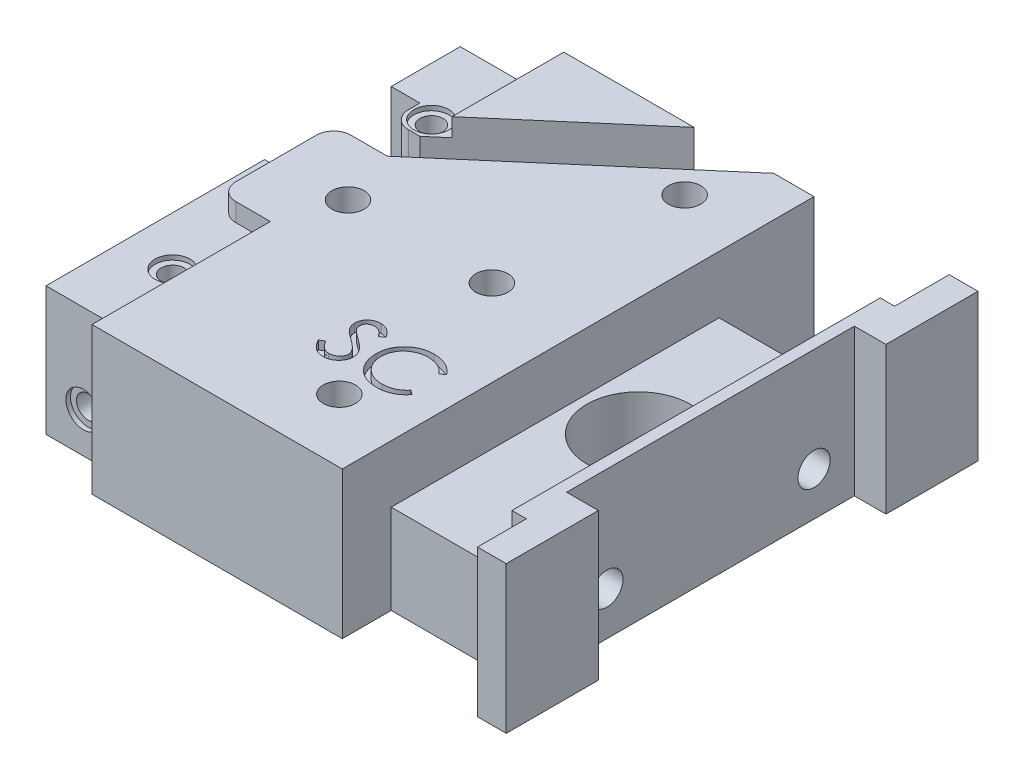
from build123d import *

# Parameters (mm, degrees)
BOSS_EXTRU_3_DEPTH       = 41
ESQUISSE8_W              = 50
ESQUISSE8_H              = 25.55
ENL_V_MAT_EXTRU_1_DEPTH  = 5.5
ESQUISSE9_R              = 9
ENL_V_MAT_EXTRU_2_DEPTH  = 96.644145142
ESQUISSE10_W             = 21
ESQUISSE10_H             = 9.5
ENL_V_MAT_EXTRU_3_DEPTH  = 96.644145142
CHANFREIN1_SIZE          = 7
ENL_V_MAT_EXTRU_6_DEPTH  = 3.175
ESQUISSE33_W             = 22
ESQUISSE33_H             = 22.375
ENL_V_MAT_EXTRU_20_DEPTH = 10
ESQUISSE34_W             = 5
ESQUISSE34_H             = 5
BOSS_EXTRU_4_DEPTH       = 22.375
ESQUISSE16_R             = 2
ENL_V_MAT_EXTRU_7_DEPTH  = 10
ESQUISSE17_R             = 3.05
ENL_V_MAT_EXTRU_8_DEPTH  = 0.8
ESQUISSE18_R             = 2.8
ENL_V_MAT_EXTRU_9_DEPTH  = 12
ESQUISSE26_W             = 13
ESQUISSE26_H             = 22.375
ENL_V_MAT_EXTRU_13_DEPTH = 5
ESQUISSE27_R             = 2
ENL_V_MAT_EXTRU_14_DEPTH = 10
ESQUISSE28_R             = 3.05
ENL_V_MAT_EXTRU_15_DEPTH = 0.8
ESQUISSE29_R             = 2.8
ENL_V_MAT_EXTRU_16_DEPTH = 10
ESQUISSE31_R             = 2.8
ENL_V_MAT_EXTRU_18_DEPTH = 10
ESQUISSE32_R             = 2.8
ENL_V_MAT_EXTRU_19_DEPTH = 10
CONG_1_R                 = 3
ENL_V_MAT_EXTRU_21_DEPTH = 16
BOSS_EXTRU_5_DEPTH       = 3.175
ESQUISSE37_W             = 2.5
ESQUISSE37_H             = 9.5
ENL_V_MAT_EXTRU_22_DEPTH = 98.769128563
ENL_V_MAT_EXTRU_23_DEPTH = 98.769128563
CHANFREIN5_SIZE          = 2
ENL_V_MAT_EXTRU_24_DEPTH = 1.5
ENL_V_MAT_EXTRU_27_REACH = 97.644
ESQUISSE42_W             = 21
ESQUISSE42_H             = 8.5
ENL_V_MAT_EXTRU_28_REACH = 99.769
ESQUISSE43_W             = 2.5
ESQUISSE43_H             = 8.5
CONG_2_R                 = 3


with BuildPart() as part:
    # Esquisse7 → Boss.-Extru.3 (new, symmetric)
    with BuildSketch(Plane.XY):
        Polygon((0, 0), (85, 0), (85, 25.55), (77.5, 25.55), (77.5, 15.55), (56.5, 15.55), (56.5, 25.55), (0, 25.55), align=None)
    extrude(amount=BOSS_EXTRU_3_DEPTH, both=True)

    # Esquisse8 → Enlèv. mat.-Extru.1 (cut)
    with BuildSketch(Plane(origin=(85, 0, 0), x_dir=(0, 0, -1), z_dir=(1, 0, 0))):
        with Locations((0, 12.775)):
            Rectangle(ESQUISSE8_W, ESQUISSE8_H)
    extrude(amount=-ENL_V_MAT_EXTRU_1_DEPTH, mode=Mode.SUBTRACT)

    # Esquisse9 → Enlèv. mat.-Extru.2 (cut, through all)
    with BuildSketch(Plane(origin=(0, 15.55, 0), x_dir=(1, 0, 0), z_dir=(0, 1, 0))):
        with Locations(Location((67, 0, 0), (0, 0, 270))):
            Circle(ESQUISSE9_R)
    extrude(amount=-ENL_V_MAT_EXTRU_2_DEPTH, mode=Mode.SUBTRACT)

    # Esquisse10 → Enlèv. mat.-Extru.3 (cut, through all)
    with BuildSketch(Plane(origin=(0, 15.55, 0), x_dir=(1, 0, 0), z_dir=(0, 1, 0))):
        with Locations((67, 36.25)):
            Rectangle(ESQUISSE10_W, ESQUISSE10_H)
    extrude(amount=-ENL_V_MAT_EXTRU_3_DEPTH, mode=Mode.SUBTRACT)

    # Chanfrein1
    chanfrein1_edges = [part.edges().sort_by_distance(p)[0] for p in [
        (67, 15.55, -31.5),
    ]]
    chamfer(chanfrein1_edges, length=CHANFREIN1_SIZE)

    # Esquisse14 → Enlèv. mat.-Extru.6 (cut)
    with BuildSketch(Plane(origin=(0, 25.55, 0), x_dir=(1, 0, 0), z_dir=(0, 1, 0))):
        Polygon((0, 41), (13, 41), (13, 10), (4, 10), (4, 0), (0, 0), (0, 10), align=None)
    enl_v_mat_extru_6 = extrude(amount=-ENL_V_MAT_EXTRU_6_DEPTH, mode=Mode.SUBTRACT)

    # Esquisse33 → Enlèv. mat.-Extru.20 (cut)
    with BuildSketch(Plane.ZY):
        with Locations((-13, 11.1875)):
            Rectangle(ESQUISSE33_W, ESQUISSE33_H)
    extrude(amount=-ENL_V_MAT_EXTRU_20_DEPTH, mode=Mode.SUBTRACT)

    # Symétrie1: Enlèv. mat.-Extru.6 across plane
    add(enl_v_mat_extru_6.mirror(Plane.XY), mode=Mode.SUBTRACT)

    # Esquisse34 → Boss.-Extru.4 (add)
    with BuildSketch(Plane(origin=(0, 22.375, 0), x_dir=(1, 0, 0), z_dir=(0, 1, 0))):
        with Locations((7.5, 21.5)):
            Rectangle(ESQUISSE34_W, ESQUISSE34_H)
    extrude(amount=-BOSS_EXTRU_4_DEPTH)

    # Esquisse16 → Enlèv. mat.-Extru.7 (cut)
    with BuildSketch(Plane(origin=(0, 22.375, 0), x_dir=(1, 0, 0), z_dir=(0, 1, 0))):
        with Locations(Location((8.5, 22.5, 0), (0, 0, 270))):
            Circle(ESQUISSE16_R)
    enl_v_mat_extru_7 = extrude(amount=-ENL_V_MAT_EXTRU_7_DEPTH, mode=Mode.SUBTRACT)

    # Esquisse17 → Enlèv. mat.-Extru.8 (cut)
    with BuildSketch(Plane(origin=(0, 22.375, 0), x_dir=(1, 0, 0), z_dir=(0, 1, 0))):
        with Locations(Location((8.5, 22.5, 0), (0, 0, 270))):
            Circle(ESQUISSE17_R)
    enl_v_mat_extru_8 = extrude(amount=-ENL_V_MAT_EXTRU_8_DEPTH, mode=Mode.SUBTRACT)

    # Symétrie2: Enlèv. mat.-Extru.7, Enlèv. mat.-Extru.8 across plane
    add(enl_v_mat_extru_7.mirror(Plane.XY), mode=Mode.SUBTRACT)
    add(enl_v_mat_extru_8.mirror(Plane.XY), mode=Mode.SUBTRACT)

    # Esquisse18 → Enlèv. mat.-Extru.9 (cut)
    with BuildSketch(Plane(origin=(79.5, 0, 0), x_dir=(0, 0, -1), z_dir=(1, 0, 0))):
        with Locations((18, 7.55)):
            Circle(ESQUISSE18_R)
    enl_v_mat_extru_9 = extrude(amount=-ENL_V_MAT_EXTRU_9_DEPTH, mode=Mode.SUBTRACT)

    # Symétrie3: Enlèv. mat.-Extru.9 across plane
    add(enl_v_mat_extru_9.mirror(Plane.XY), mode=Mode.SUBTRACT)

    # Esquisse26 → Enlèv. mat.-Extru.13 (cut)
    with BuildSketch(Plane(origin=(0, 0, -41), x_dir=(-1, 0, 0), z_dir=(0, 0, -1))):
        with Locations((-6.5, 11.1875)):
            Rectangle(ESQUISSE26_W, ESQUISSE26_H)
    enl_v_mat_extru_13 = extrude(amount=-ENL_V_MAT_EXTRU_13_DEPTH, mode=Mode.SUBTRACT)

    # Esquisse27 → Enlèv. mat.-Extru.14 (cut)
    with BuildSketch(Plane(origin=(0, 0, -36), x_dir=(-1, 0, 0), z_dir=(0, 0, -1))):
        with Locations((-6.5, 7)):
            Circle(ESQUISSE27_R)
    enl_v_mat_extru_14 = extrude(amount=-ENL_V_MAT_EXTRU_14_DEPTH, mode=Mode.SUBTRACT)

    # Esquisse28 → Enlèv. mat.-Extru.15 (cut)
    with BuildSketch(Plane(origin=(0, 0, -36), x_dir=(-1, 0, 0), z_dir=(0, 0, -1))):
        with Locations((-6.5, 7)):
            Circle(ESQUISSE28_R)
    enl_v_mat_extru_15 = extrude(amount=-ENL_V_MAT_EXTRU_15_DEPTH, mode=Mode.SUBTRACT)

    # Symétrie4: Enlèv. mat.-Extru.13, Enlèv. mat.-Extru.14, Enlèv. mat.-Extru.15 across plane
    add(enl_v_mat_extru_13.mirror(Plane.XY), mode=Mode.SUBTRACT)
    add(enl_v_mat_extru_14.mirror(Plane.XY), mode=Mode.SUBTRACT)
    add(enl_v_mat_extru_15.mirror(Plane.XY), mode=Mode.SUBTRACT)

    # Esquisse29 → Enlèv. mat.-Extru.16 (cut)
    with BuildSketch(Plane(origin=(0, 25.55, 0), x_dir=(1, 0, 0), z_dir=(0, 1, 0))):
        with Locations(Location((41.5, 0, 0), (0, 0, 270))):
            Circle(ESQUISSE29_R)
        with Locations(Location((16.5, 0, 0), (0, 0, 270))):
            Circle(ESQUISSE29_R)
    extrude(amount=-ENL_V_MAT_EXTRU_16_DEPTH, mode=Mode.SUBTRACT)

    # Esquisse31 → Enlèv. mat.-Extru.18 (cut)
    with BuildSketch(Plane(origin=(0, 25.55, 0), x_dir=(1, 0, 0), z_dir=(0, 1, 0))):
        with Locations(Location((45, -30, 0), (0, 0, 270))):
            Circle(ESQUISSE31_R)
        with Locations(Location((45, 30, 0), (0, 0, 270))):
            Circle(ESQUISSE31_R)
    extrude(amount=-ENL_V_MAT_EXTRU_18_DEPTH, mode=Mode.SUBTRACT)

    # Esquisse32 → Enlèv. mat.-Extru.19 (cut)
    with BuildSketch(Plane.XZ):
        with Locations(Location((11, 15, 0), (0, 0, 270))):
            Circle(ESQUISSE32_R)
        with Locations(Location((43, -15, 0), (0, 0, 270))):
            Circle(ESQUISSE32_R)
    extrude(amount=-ENL_V_MAT_EXTRU_19_DEPTH, mode=Mode.SUBTRACT)

    # Congé1
    cong_1_edges = [part.edges().sort_by_distance(p)[0] for p in [
        (5, 11.1875, -19),
    ]]
    fillet(cong_1_edges, radius=CONG_1_R)

    # Esquisse35 → Enlèv. mat.-Extru.21 (cut)
    with BuildSketch(Plane(origin=(0, 25.55, 0), x_dir=(1, 0, 0), z_dir=(0, 1, 0))):
        Polygon((4, 2), (49.484592656, 41), (35.657975345, 41), (10, 19), (4, 10), align=None)
    extrude(amount=-ENL_V_MAT_EXTRU_21_DEPTH, mode=Mode.SUBTRACT)

    # Esquisse36 → Boss.-Extru.5 (add)
    with BuildSketch(Plane(origin=(0, 25.55, 0), x_dir=(1, 0, 0), z_dir=(0, 1, 0))):
        Polygon((4, 1.982787623), (4, 10), (13.330172853, 10), align=None)
    extrude(amount=-BOSS_EXTRU_5_DEPTH)

    # Esquisse37 → Enlèv. mat.-Extru.22 (cut, through all)
    with BuildSketch(Plane(origin=(0, 25.55, 0), x_dir=(1, 0, 0), z_dir=(0, 1, 0))):
        with Locations((78.75, 36.25)):
            Rectangle(ESQUISSE37_W, ESQUISSE37_H)
    extrude(amount=-ENL_V_MAT_EXTRU_22_DEPTH, mode=Mode.SUBTRACT)

    # Esquisse38 → Enlèv. mat.-Extru.23 (cut, through all)
    with BuildSketch(Plane(origin=(0, 25.55, 0), x_dir=(1, 0, 0), z_dir=(0, 1, 0))):
        Polygon((49.484592656, 41), (41.087437089, 33.8), (27.260819777, 33.8), (35.657975345, 41), align=None)
    extrude(amount=-ENL_V_MAT_EXTRU_23_DEPTH, mode=Mode.SUBTRACT)

    # Chanfrein5
    chanfrein5_edges = [part.edges().sort_by_distance(p)[0] for p in [
        (34.174128433, 9.55, -33.8),
    ]]
    chamfer(chanfrein5_edges, length=CHANFREIN5_SIZE)

    # Esquisse39 → Enlèv. mat.-Extru.24 (cut)
    with BuildSketch(Plane(origin=(0, 25.55, 0), x_dir=(1, 0, 0), z_dir=(0, 1, 0))):
        with BuildLine():
            Line((34.994230769, -23.662545072), (35.799429087, -23.179807692))
            add(Edge.make_bspline(
                [(35.799429087, -23.179807692), (35.874318004, -23.305168626), (36.017802279, -23.545355336), (36.25715562, -23.869907575), (36.505167329, -24.145757444), (36.763674015, -24.371300212), (37.031097774, -24.548870396), (37.309184377, -24.67460647), (37.596996705, -24.753027089), (37.792868319, -24.762552324), (37.890655048, -24.767307692)],
                knots=[0, 0, 0, 0, 1.272034388, 2.437168799, 3.508375237, 4.49857839, 5.41946034, 6.295179144, 7.148887113, 8, 8, 8, 8], degree=3))
            add(Edge.make_bspline(
                [(37.890655048, -24.767307692), (37.974167147, -24.764981762), (38.139730079, -24.7603706), (38.383467326, -24.71606356), (38.620182088, -24.647994838), (38.844995595, -24.550510731), (39.054805803, -24.432568138), (39.238792596, -24.290111755), (39.397849518, -24.130619152), (39.527958608, -23.952684928), (39.627780704, -23.761321831), (39.704503405, -23.564900135), (39.747080355, -23.360334245), (39.753494091, -23.222601486), (39.756730769, -23.153094952)],
                knots=[0, 0, 0, 0, 1.095163259, 2.171163733, 3.241058638, 4.321873601, 5.38011039, 6.391990106, 7.366004449, 8.327778327, 9.272591725, 10.192022065, 11.087607919, 12, 12, 12, 12], degree=3))
            add(Edge.make_bspline(
                [(39.756730769, -23.153094952), (39.752718538, -23.073790211), (39.744562258, -22.912575261), (39.675624444, -22.674723348), (39.567177566, -22.439339997), (39.467130657, -22.293740124), (39.415189303, -22.218149038)],
                knots=[0, 0, 0, 0, 0.938893495, 1.908633276, 2.914225137, 4, 4, 4, 4], degree=3))
            add(Edge.make_bspline(
                [(39.415189303, -22.218149038), (39.372542846, -22.16359304), (39.283011943, -22.049059545), (39.129094713, -21.878575012), (38.948484073, -21.7027206), (38.747360827, -21.514781309), (38.518398635, -21.323498091), (38.268768757, -21.11974942), (37.992097826, -20.9112837), (37.798061339, -20.771476932), (37.697941707, -20.699338942)],
                knots=[0, 0, 0, 0, 0.722233717, 1.516239348, 2.393582979, 3.351407094, 4.387010283, 5.505090956, 6.712668013, 8, 8, 8, 8], degree=3))
            add(Edge.make_bspline(
                [(37.697941707, -20.699338942), (37.597727831, -20.627959715), (37.406126533, -20.491488067), (37.138178534, -20.288947694), (36.898571817, -20.103771163), (36.68837135, -19.934215244), (36.50766959, -19.780256941), (36.355042593, -19.643374693), (36.234378377, -19.519866574), (36.167279975, -19.439744065), (36.137154447, -19.403771034)],
                knots=[0, 0, 0, 0, 1.452282411, 2.77665338, 3.964542531, 5.026858415, 5.96415736, 6.766646006, 7.446254459, 8, 8, 8, 8], degree=3))
            add(Edge.make_bspline(
                [(36.137154447, -19.403771034), (36.09504702, -19.347706783), (36.012237115, -19.237448911), (35.9029282, -19.065114834), (35.810020907, -18.888702947), (35.737189132, -18.707739201), (35.675858422, -18.524764145), (35.634607196, -18.337390398), (35.608777037, -18.146458729), (35.606131845, -18.017970559), (35.604807692, -17.953650841)],
                knots=[0, 0, 0, 0, 1.068054152, 2.10047183, 3.106115577, 4.101338837, 5.06977816, 6.043150881, 7.020423561, 8, 8, 8, 8], degree=3))
            add(Edge.make_bspline(
                [(35.604807692, -17.953650841), (35.608359725, -17.852876955), (35.615387869, -17.653483153), (35.674825277, -17.362206393), (35.768640795, -17.084113357), (35.900071882, -16.821957235), (36.069500821, -16.582564101), (36.265568794, -16.363180255), (36.499098625, -16.178752899), (36.755328264, -16.017611511), (37.035788819, -15.891484386), (37.329678349, -15.796340576), (37.637463952, -15.742431096), (37.845933912, -15.734694714), (37.95171274, -15.730769231)],
                knots=[0, 0, 0, 0, 1.005424448, 1.989358655, 2.955360095, 3.929531133, 4.905563448, 5.876582895, 6.856512386, 7.866279853, 8.892233794, 9.918561126, 10.94386622, 12, 12, 12, 12], degree=3))
            add(Edge.make_bspline(
                [(37.95171274, -15.730769231), (38.063955613, -15.734640603), (38.287170863, -15.742339528), (38.615509086, -15.809279952), (38.931632178, -15.920043923), (39.185931349, -16.045743057), (39.384956936, -16.17128641), (39.536738444, -16.28564036), (39.690546649, -16.417289763), (39.847622213, -16.566585282), (40.005303579, -16.734896798), (40.165931688, -16.921071601), (40.329882162, -17.123971943), (40.435353467, -17.26881862), (40.489423077, -17.343073918)],
                knots=[0, 0, 0, 0, 1.286793592, 2.559021753, 3.825965368, 5.121522368, 5.803751409, 6.523245864, 7.299691795, 8.125521123, 9.008227632, 9.944561021, 10.946284179, 12, 12, 12, 12], degree=3))
            Line((40.489423077, -17.343073918), (39.716661659, -17.928846154))
            add(Edge.make_bspline(
                [(39.716661659, -17.928846154), (39.670000228, -17.868733361), (39.580141223, -17.752970176), (39.443717405, -17.590851095), (39.315133585, -17.442760533), (39.188449997, -17.314131863), (39.070357328, -17.197921058), (38.955738806, -17.098426291), (38.846243893, -17.014672706), (38.708221443, -16.925291304), (38.534818224, -16.836691105), (38.317146022, -16.761718257), (38.089671945, -16.716664838), (37.934742019, -16.710707937), (37.856310096, -16.707692308)],
                knots=[0, 0, 0, 0, 1.181633172, 2.275549214, 3.290209073, 4.226197932, 5.078386478, 5.862611352, 6.581680152, 7.217281963, 8.414376989, 9.595101626, 10.782541182, 12, 12, 12, 12], degree=3))
            add(Edge.make_bspline(
                [(37.856310096, -16.707692308), (37.757912703, -16.710989863), (37.5681626, -16.717348886), (37.298767743, -16.786799704), (37.05630499, -16.896151766), (36.847972652, -17.049408957), (36.674517022, -17.230985372), (36.549044309, -17.439933542), (36.473524218, -17.670662795), (36.4643087, -17.831612588), (36.459615385, -17.913581731)],
                knots=[0, 0, 0, 0, 1.14458467, 2.207223713, 3.21896685, 4.227309161, 5.202851033, 6.127160689, 7.046193047, 8, 8, 8, 8], degree=3))
            add(Edge.make_bspline(
                [(36.459615385, -17.913581731), (36.460685251, -17.96461254), (36.462826732, -18.066757605), (36.49269386, -18.217664689), (36.531064177, -18.368190548), (36.591868053, -18.517658434), (36.675811344, -18.668682368), (36.786043287, -18.823862954), (36.924872372, -18.984567961), (37.03121767, -19.089090886), (37.087364784, -19.144275841)],
                knots=[0, 0, 0, 0, 0.858281714, 1.717966888, 2.583508476, 3.4729293, 4.427298488, 5.488583878, 6.674047936, 8, 8, 8, 8], degree=3))
            add(Edge.make_bspline(
                [(37.087364784, -19.144275841), (37.108214661, -19.162882319), (37.157749198, -19.20708705), (37.248307253, -19.279456042), (37.36789444, -19.368726444), (37.513388002, -19.479181927), (37.687470608, -19.607310763), (37.8901614, -19.751474665), (38.119201, -19.916353664), (38.281729928, -20.031626685), (38.367668269, -20.092578125)],
                knots=[0, 0, 0, 0, 0.420754252, 0.999615792, 1.744751191, 2.668019286, 3.750313428, 4.999500688, 6.413464383, 8, 8, 8, 8], degree=3))
            add(Edge.make_bspline(
                [(38.367668269, -20.092578125), (38.471044219, -20.167802111), (38.671217418, -20.313462933), (38.956035546, -20.532308462), (39.214282267, -20.746342747), (39.446864271, -20.954198949), (39.656079286, -21.154300402), (39.839606226, -21.349054486), (39.999315113, -21.537065937), (40.171252843, -21.778109875), (40.346942338, -22.074149826), (40.49782244, -22.436857032), (40.592959086, -22.800974162), (40.605400139, -23.045703624), (40.611538462, -23.166451322)],
                knots=[0, 0, 0, 0, 1.163667725, 2.253281268, 3.268753668, 4.215851969, 5.092017293, 5.902905408, 6.650798638, 7.335211899, 8.59617414, 9.77448103, 10.901945474, 12, 12, 12, 12], degree=3))
            add(Edge.make_bspline(
                [(40.611538462, -23.166451322), (40.609750107, -23.251845301), (40.606208127, -23.420974967), (40.565493069, -23.66931914), (40.505840266, -23.910521721), (40.415931793, -24.141601249), (40.306195198, -24.36678521), (40.166949909, -24.58016671), (40.005548282, -24.786468409), (39.82039925, -24.980189197), (39.617800044, -25.158024201), (39.40366799, -25.31621829), (39.177652604, -25.44812137), (38.940979985, -25.555756162), (38.693595769, -25.63993952), (38.435583157, -25.700934543), (38.166516844, -25.738369727), (37.983635534, -25.742255278), (37.890655048, -25.744230769)],
                knots=[0, 0, 0, 0, 0.983748083, 1.948392443, 2.894712957, 3.844097841, 4.80183111, 5.778335162, 6.776009319, 7.81870978, 8.863265674, 9.881300176, 10.883814829, 11.87499822, 12.874611388, 13.892143829, 14.928324115, 16, 16, 16, 16], degree=3))
            add(Edge.make_bspline(
                [(37.890655048, -25.744230769), (37.81871315, -25.742839625), (37.675735389, -25.740074857), (37.464254585, -25.715632943), (37.257046131, -25.681051469), (37.056710121, -25.626149178), (36.860665451, -25.559536834), (36.669764763, -25.477517514), (36.483915537, -25.37922713), (36.302076258, -25.26684567), (36.124709397, -25.136059951), (35.95347856, -24.983732079), (35.782765562, -24.81406324), (35.617609148, -24.622445921), (35.454668662, -24.411975853), (35.297156705, -24.180683861), (35.141812887, -23.929829777), (35.04434365, -23.753304079), (34.994230769, -23.662545072)],
                knots=[0, 0, 0, 0, 0.915332311, 1.819136955, 2.706846663, 3.586547465, 4.459518054, 5.340707479, 6.227863349, 7.133153174, 8.059268498, 9.028702269, 10.047606654, 11.120612155, 12.245963614, 13.433783089, 14.680604001, 16, 16, 16, 16], degree=3))
        make_face()
        with BuildLine():
            Line((51.357692308, -17.722776442), (50.609735577, -18.295192308))
            add(Edge.make_bspline(
                [(50.609735577, -18.295192308), (50.556379552, -18.23160349), (50.450386858, -18.105283169), (50.279864314, -17.927901695), (50.102150557, -17.761716947), (49.91731352, -17.605937261), (49.722026202, -17.466010205), (49.521019314, -17.334643847), (49.310930348, -17.216893788), (49.020413127, -17.074119519), (48.640371483, -16.925131769), (48.161958385, -16.800209403), (47.662546039, -16.720686061), (47.321829714, -16.712073171), (47.148527644, -16.707692308)],
                knots=[0, 0, 0, 0, 0.757959112, 1.505699292, 2.245454638, 2.979532153, 3.711538275, 4.438200793, 5.171680507, 5.909471876, 7.393775596, 8.890124382, 10.418191784, 12, 12, 12, 12], degree=3))
            add(Edge.make_bspline(
                [(47.148527644, -16.707692308), (47.053050951, -16.708791663), (46.862983678, -16.71098017), (46.580911761, -16.739852146), (46.304106958, -16.780431939), (46.032749325, -16.840644426), (45.767184273, -16.916769911), (45.505675665, -17.007734787), (45.252009675, -17.12027903), (45.002677184, -17.244670795), (44.763792331, -17.385171198), (44.537763951, -17.538423963), (44.32541641, -17.702714147), (44.12658173, -17.878657515), (43.941056642, -18.065461707), (43.77018546, -18.265117523), (43.614559451, -18.476986652), (43.471093833, -18.698275282), (43.342607751, -18.928338844), (43.235030008, -19.168028857), (43.139766068, -19.413240737), (43.064384558, -19.666744968), (43.004718552, -19.926757781), (42.963549697, -20.193976997), (42.935006071, -20.467844367), (42.932828447, -20.65347114), (42.931730769, -20.747040264)],
                knots=[0, 0, 0, 0, 1.054917814, 2.100044995, 3.131103042, 4.146048494, 5.169673617, 6.183595914, 7.203665975, 8.234915748, 9.262203917, 10.264457458, 11.251630812, 12.227803204, 13.197192746, 14.159520551, 15.12972552, 16.100847026, 17.073214652, 18.039054194, 19.002613845, 19.979014051, 20.95965708, 21.949030935, 22.966165397, 24, 24, 24, 24], degree=3))
            add(Edge.make_bspline(
                [(42.931730769, -20.747040264), (42.93516472, -20.887823356), (42.941906826, -21.164232284), (43.001909792, -21.569100874), (43.093091505, -21.956960708), (43.22974961, -22.325387278), (43.398257884, -22.678923596), (43.611184119, -23.011587904), (43.857790553, -23.328407269), (44.141565938, -23.621894148), (44.452913194, -23.889992215), (44.786962868, -24.126077726), (45.142882965, -24.322877513), (45.516743652, -24.486642053), (45.911421862, -24.612526434), (46.32620786, -24.70114737), (46.760199504, -24.758956447), (47.056751942, -24.764490984), (47.207677284, -24.767307692)],
                knots=[0, 0, 0, 0, 1.029171465, 2.020641659, 2.987623507, 3.938342917, 4.889210282, 5.84687017, 6.821220943, 7.821438502, 8.827599549, 9.822697543, 10.807740252, 11.797342354, 12.80366471, 13.83203677, 14.896651826, 16, 16, 16, 16], degree=3))
            add(Edge.make_bspline(
                [(47.207677284, -24.767307692), (47.373963887, -24.762711799), (47.701255702, -24.753665981), (48.181228688, -24.677032596), (48.640703165, -24.552777834), (49.079703847, -24.378884202), (49.496993134, -24.152827955), (49.893224045, -23.878785874), (50.268731033, -23.554151197), (50.494531451, -23.306274969), (50.609735577, -23.179807692)],
                knots=[0, 0, 0, 0, 1.028121516, 2.023589091, 2.998037872, 3.967518031, 4.937445131, 5.927275754, 6.942489185, 8, 8, 8, 8], degree=3))
            Line((50.609735577, -23.179807692), (51.357692308, -23.746499399))
            add(Edge.make_bspline(
                [(51.357692308, -23.746499399), (51.297499452, -23.824164757), (51.17740206, -23.979123462), (50.98293417, -24.197577186), (50.778072383, -24.403056025), (50.561295057, -24.593903338), (50.335095925, -24.77393799), (50.095413417, -24.938045117), (49.845398408, -25.088515309), (49.585898004, -25.226292868), (49.317187922, -25.348531947), (49.039590139, -25.45318113), (48.754301215, -25.543328151), (48.46130811, -25.61749235), (48.160003086, -25.675380085), (47.851473439, -25.714077915), (47.535053279, -25.740589839), (47.321580554, -25.743006238), (47.213401442, -25.744230769)],
                knots=[0, 0, 0, 0, 0.986787822, 1.968848986, 2.935600012, 3.899624008, 4.868462664, 5.837806735, 6.815139263, 7.798259679, 8.787526145, 9.778297419, 10.776456485, 11.791383307, 12.812564526, 13.85620153, 14.913611965, 16, 16, 16, 16], degree=3))
            add(Edge.make_bspline(
                [(47.213401442, -25.744230769), (47.110956891, -25.743517775), (46.908385477, -25.742107918), (46.609303875, -25.719269234), (46.318139373, -25.688109592), (46.035724141, -25.641191807), (45.760517023, -25.585826139), (45.495012861, -25.511609362), (45.236599039, -25.428471987), (44.986313769, -25.33075913), (44.743944157, -25.220497234), (44.510271928, -25.095878777), (44.285404551, -24.957951702), (44.067131227, -24.809756281), (43.858676374, -24.646532338), (43.658233566, -24.470546711), (43.464678827, -24.282392554), (43.344928663, -24.146716131), (43.284720553, -24.078500601)],
                knots=[0, 0, 0, 0, 1.114604814, 2.203992996, 3.262667896, 4.300477797, 5.318619304, 6.316056647, 7.298880507, 8.271930387, 9.238335007, 10.195173496, 11.151986948, 12.108099108, 13.064862484, 14.031167946, 15.010108607, 16, 16, 16, 16], degree=3))
            add(Edge.make_bspline(
                [(43.284720553, -24.078500601), (43.18828498, -23.960006365), (42.99657809, -23.724448461), (42.751307479, -23.342670183), (42.541355919, -22.944067415), (42.371604306, -22.526546037), (42.23890001, -22.091042933), (42.146966901, -21.637338569), (42.087227177, -21.165856669), (42.080395606, -20.845172266), (42.076923077, -20.682166466)],
                knots=[0, 0, 0, 0, 0.994628077, 1.977248131, 2.950237994, 3.925870899, 4.908910175, 5.911660606, 6.938484602, 8, 8, 8, 8], degree=3))
            add(Edge.make_bspline(
                [(42.076923077, -20.682166466), (42.081155425, -20.510837696), (42.089482306, -20.173759037), (42.160228006, -19.679074207), (42.274034873, -19.205133615), (42.435679263, -18.752821996), (42.640617398, -18.319760304), (42.893782682, -17.90925674), (43.192233977, -17.518686021), (43.533630571, -17.153974447), (43.908010248, -16.820492352), (44.308927877, -16.527105469), (44.735598747, -16.282945658), (45.183322329, -16.078848959), (45.65545122, -15.92197367), (46.150978103, -15.812155354), (46.668971864, -15.743800916), (47.02238318, -15.735159815), (47.201953125, -15.730769231)],
                knots=[0, 0, 0, 0, 1.032925535, 2.032216505, 3.007276963, 3.968222605, 4.92396291, 5.891752235, 6.871517503, 7.883894988, 8.900124299, 9.891468569, 10.874487609, 11.85992873, 12.854644235, 13.869047385, 14.917252991, 16, 16, 16, 16], degree=3))
            add(Edge.make_bspline(
                [(47.201953125, -15.730769231), (47.311393938, -15.732081335), (47.528021006, -15.734678514), (47.848476438, -15.760004515), (48.160467342, -15.802223687), (48.464208658, -15.859689562), (48.761178063, -15.931010916), (49.049105862, -16.023921299), (49.329681574, -16.130156431), (49.601135659, -16.252507684), (49.8621657, -16.389849316), (50.112690395, -16.540658978), (50.35071976, -16.704749706), (50.577928698, -16.880725919), (50.790516387, -17.072310569), (50.994518696, -17.274234027), (51.183007773, -17.492312505), (51.299357539, -17.645814504), (51.357692308, -17.722776442)],
                knots=[0, 0, 0, 0, 1.096760587, 2.17092713, 3.219439832, 4.250915756, 5.268269357, 6.278326846, 7.281116186, 8.274029601, 9.260640565, 10.235837813, 11.203064059, 12.156899882, 13.114053108, 14.069676657, 15.032185724, 16, 16, 16, 16], degree=3))
        make_face()
    extrude(amount=-ENL_V_MAT_EXTRU_24_DEPTH, mode=Mode.SUBTRACT)

    # Esquisse42 → Enlèv. mat.-Extru.27 (cut, up to next)
    with BuildSketch(Plane(origin=(0, 15.55, 0), x_dir=(1, 0, 0), z_dir=(0, 1, 0)), mode=Mode.PRIVATE) as enl_v_mat_extru_27_sk1:
        with Locations((67, -36.75)):
            Rectangle(ESQUISSE42_W, ESQUISSE42_H)
    enl_v_mat_extru_27_tool1 = extrude(enl_v_mat_extru_27_sk1.sketch, amount=-ENL_V_MAT_EXTRU_27_REACH, mode=Mode.PRIVATE) & part.part
    add(enl_v_mat_extru_27_tool1.solids().sort_by_distance((67, 15.55, 36.75))[0], mode=Mode.SUBTRACT)

    # Esquisse43 → Enlèv. mat.-Extru.28 (cut, up to next)
    with BuildSketch(Plane(origin=(0, 25.55, 0), x_dir=(1, 0, 0), z_dir=(0, 1, 0)), mode=Mode.PRIVATE) as enl_v_mat_extru_28_sk1:
        with Locations((78.75, -36.75)):
            Rectangle(ESQUISSE43_W, ESQUISSE43_H)
    enl_v_mat_extru_28_tool1 = extrude(enl_v_mat_extru_28_sk1.sketch, amount=-ENL_V_MAT_EXTRU_28_REACH, mode=Mode.PRIVATE) & part.part
    add(enl_v_mat_extru_28_tool1.solids().sort_by_distance((78.75, 25.55, 36.75))[0], mode=Mode.SUBTRACT)

    # Congé2
    cong_2_edges = [part.edges().sort_by_distance(p)[0] for p in [
        (4, 23.9625, 10),
        (4, 23.9625, -10),
    ]]
    fillet(cong_2_edges, radius=CONG_2_R)


solid = part.part
